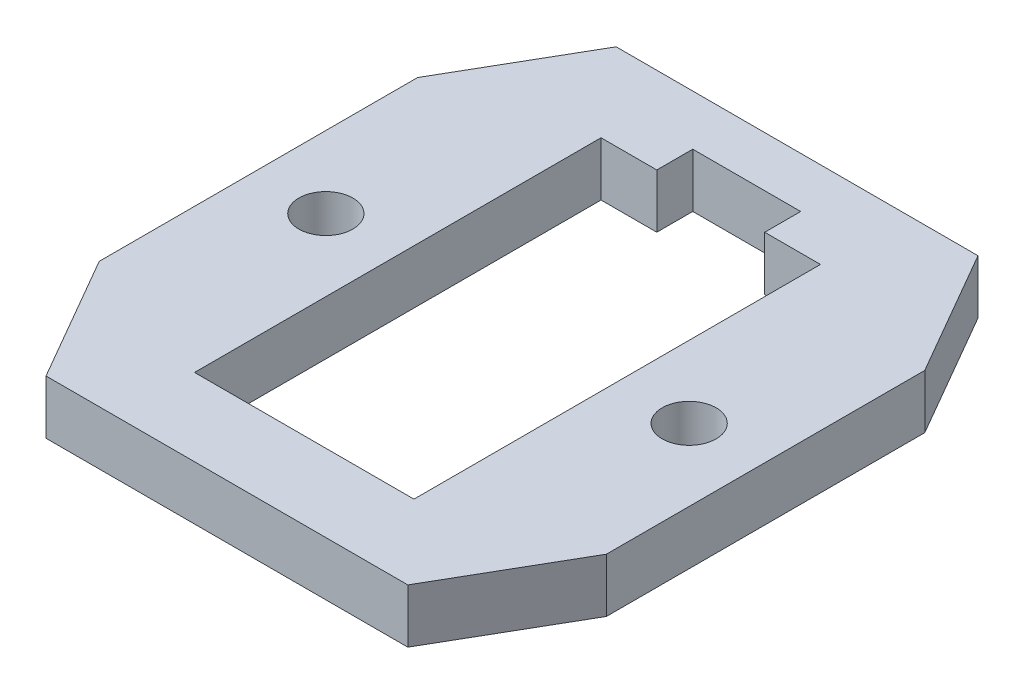
from build123d import *

# Parameters (mm, degrees)
SKETCH1_W           = 28.2
SKETCH1_H           = 32.2
SKETCH1_R           = 1.5
BOSS_EXTRUDE1_DEPTH = 3
CHAMFER1_SIZE       = 7
CHAMFER1_SIZE2      = 4.041451884
CHAMFER3_SIZE       = 7
CHAMFER3_SIZE2      = 4.041451884
SKETCH2_W           = 28.2
SKETCH2_H           = 3
CUT_EXTRUDE1_DEPTH  = 0.5
CHAMFER4_SIZE       = 7
CHAMFER4_SIZE2      = 4.041451884
CHAMFER5_SIZE       = 7
CHAMFER5_SIZE2      = 4.041451884


with BuildPart() as part:
    # Sketch1 → Boss-Extrude1 (new body)
    with BuildSketch(Plane(origin=(0, 0, 0), x_dir=(1, 0, 0), z_dir=(0, 1, 0))):
        Rectangle(SKETCH1_W, SKETCH1_H)
        with Locations(Location((10.1, 0, 0), (0, 0, 270))):
            Circle(SKETCH1_R, mode=Mode.SUBTRACT)
        with Locations(Location((-10.1, 0, 0), (0, 0, 90))):
            Circle(SKETCH1_R, mode=Mode.SUBTRACT)
        Polygon((-6.1, -11.3), (6.1, -11.3), (6.1, 11.3), (3, 11.3), (3, 13.3), (-3, 13.3), (-3, 11.3), (-6.1, 11.3), align=None, mode=Mode.SUBTRACT)
    extrude(amount=BOSS_EXTRUDE1_DEPTH)

    # Chamfer1
    chamfer1_edges = [part.edges().sort_by_distance(p)[0] for p in [
        (14.1, 1.5, -16.1),
    ]]
    chamfer1_side = [part.faces().sort_by_distance(p)[0] for p in [
        (14.1, 1.5, 0),
    ]]
    chamfer(chamfer1_edges, length=CHAMFER1_SIZE, length2=CHAMFER1_SIZE2, reference=chamfer1_side[0])

    # Chamfer3
    chamfer3_edges = [part.edges().sort_by_distance(p)[0] for p in [
        (-14.1, 1.5, -16.1),
    ]]
    chamfer3_side = [part.faces().sort_by_distance(p)[0] for p in [
        (-14.1, 1.5, 0),
    ]]
    chamfer(chamfer3_edges, length=CHAMFER3_SIZE, length2=CHAMFER3_SIZE2, reference=chamfer3_side[0])

    # Sketch2 → Cut-Extrude1 (cut)
    with BuildSketch(Plane.XY.offset(16.1)):
        with Locations((0, 1.5)):
            Rectangle(SKETCH2_W, SKETCH2_H)
    extrude(amount=-CUT_EXTRUDE1_DEPTH, mode=Mode.SUBTRACT)

    # Chamfer4
    chamfer4_edges = [part.edges().sort_by_distance(p)[0] for p in [
        (-14.1, 1.5, 15.6),
    ]]
    chamfer4_side = [part.faces().sort_by_distance(p)[0] for p in [
        (-14.1, 1.5, 3.25),
    ]]
    chamfer(chamfer4_edges, length=CHAMFER4_SIZE, length2=CHAMFER4_SIZE2, reference=chamfer4_side[0])

    # Chamfer5
    chamfer5_edges = [part.edges().sort_by_distance(p)[0] for p in [
        (14.1, 1.5, 15.6),
    ]]
    chamfer5_side = [part.faces().sort_by_distance(p)[0] for p in [
        (14.1, 1.5, 3.25),
    ]]
    chamfer(chamfer5_edges, length=CHAMFER5_SIZE, length2=CHAMFER5_SIZE2, reference=chamfer5_side[0])


solid = part.part
